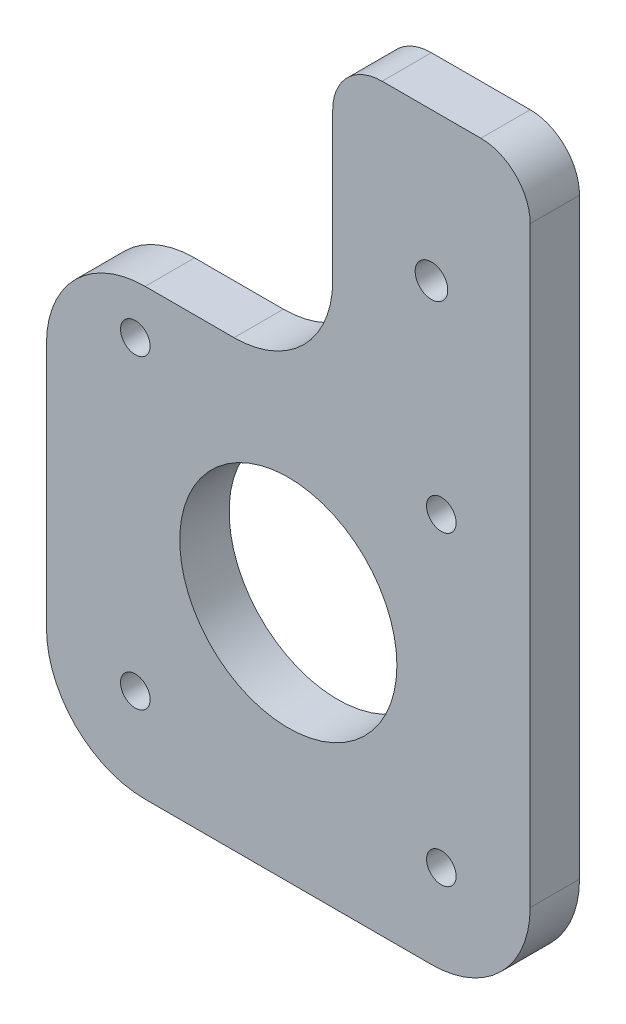
from build123d import *

# Parameters (mm, degrees)
SKETCH1_R           = 1.5
SKETCH1_R_2         = 11
SKETCH1_R_3         = 1.65
BOSS_EXTRUDE1_DEPTH = 5
FILLET1_R           = 10
FILLET2_R           = 5


with BuildPart() as part:
    # Sketch1 → Boss-Extrude1 (new body)
    with BuildSketch(Plane.XY):
        Polygon((23.883435073, 30), (43.883435073, 30), (43.883435073, -45), (-5.116564927, -45), (-5.116564927, 0), (0, 0), (23.883435073, 0), align=None)
        with Locations((3.883435073, -5)):
            Circle(SKETCH1_R, mode=Mode.SUBTRACT)
        with Locations((34.883435073, -5)):
            Circle(SKETCH1_R, mode=Mode.SUBTRACT)
        with Locations((3.883435073, -36)):
            Circle(SKETCH1_R, mode=Mode.SUBTRACT)
        with Locations((34.883435073, -36)):
            Circle(SKETCH1_R, mode=Mode.SUBTRACT)
        with Locations((19.383435073, -20.5)):
            Circle(SKETCH1_R_2, mode=Mode.SUBTRACT)
        with Locations((33.883435073, 15)):
            Circle(SKETCH1_R_3, mode=Mode.SUBTRACT)
    extrude(amount=BOSS_EXTRUDE1_DEPTH)

    # Fillet1
    fillet1_edges = [part.edges().sort_by_distance(p)[0] for p in [
        (23.883435073, 0, 2.5),
        (43.883435073, -45, 2.5),
        (-5.116564927, -45, 2.5),
        (-5.116564927, 0, 2.5),
    ]]
    fillet(fillet1_edges, radius=FILLET1_R)

    # Fillet2
    fillet2_edges = [part.edges().sort_by_distance(p)[0] for p in [
        (23.883435073, 30, 2.5),
        (43.883435073, 30, 2.5),
    ]]
    fillet(fillet2_edges, radius=FILLET2_R)


solid = part.part
